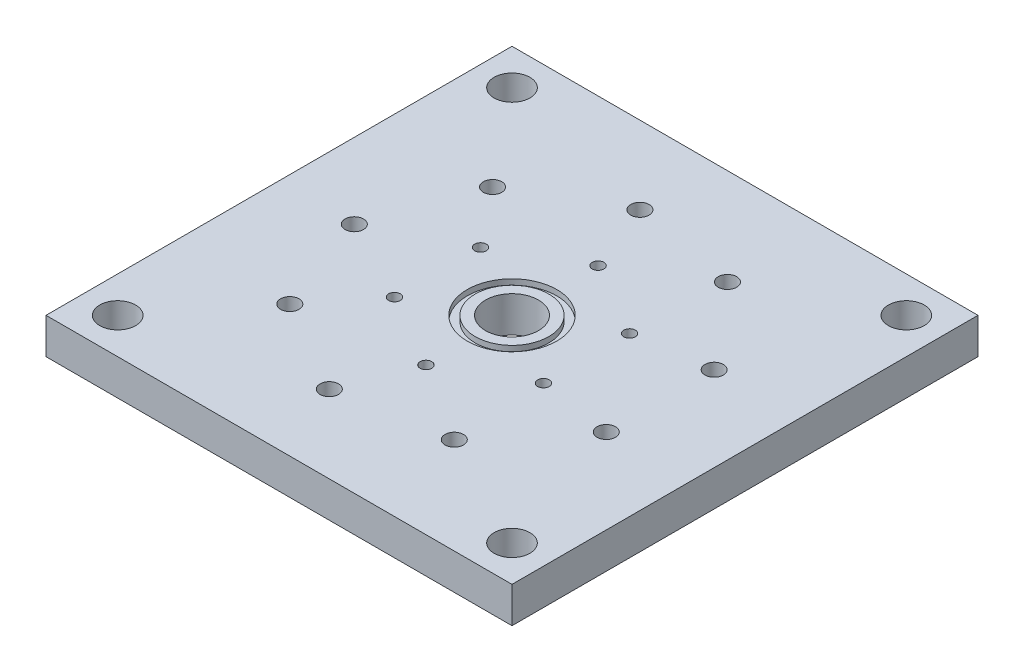
from build123d import *

# Parameters (mm, degrees)
SKETCH1_W           = 82.55
SKETCH1_H           = 82.55
BOSS_EXTRUDE1_DEPTH = 6.35
CUT_EXTRUDE1_REACH  = 60.716
SKETCH2_R           = 4.699
SKETCH4_R           = 7.9248
SKETCH4_R_2         = 6.5278
CUT_EXTRUDE3_DEPTH  = 0.9779
SKETCH5_R           = 1.03251
CUT_EXTRUDE4_DEPTH  = 3.175
CIRPATTERN1_COUNT   = 6
CUT_EXTRUDE5_REACH  = 60.716
SKETCH6_R           = 1.63195
CIRPATTERN2_COUNT   = 9
CUT_EXTRUDE6_REACH  = 60.716
SKETCH7_R           = 3.175


with BuildPart() as part:
    # Sketch1 → Boss-Extrude1 (new body)
    with BuildSketch(Plane(origin=(0, 0, 0), x_dir=(1, 0, 0), z_dir=(0, 1, 0))):
        Rectangle(SKETCH1_W, SKETCH1_H)
    extrude(amount=BOSS_EXTRUDE1_DEPTH)

    # Sketch2 → Cut-Extrude1 (cut, up to next)
    with BuildSketch(Plane(origin=(0, 6.35, 0), x_dir=(1, 0, 0), z_dir=(0, 1, 0)), mode=Mode.PRIVATE) as cut_extrude1_sk1:
        with Locations(Location((0, 0, 0), (0, 0, 270))):
            Circle(SKETCH2_R)
    cut_extrude1_tool1 = extrude(cut_extrude1_sk1.sketch, amount=-CUT_EXTRUDE1_REACH, mode=Mode.PRIVATE) & part.part
    add(cut_extrude1_tool1.solids().sort_by_distance((0, 6.35, 0))[0], mode=Mode.SUBTRACT)

    # Sketch4 → Cut-Extrude3 (cut)
    with BuildSketch(Plane(origin=(0, 6.35, 0), x_dir=(1, 0, 0), z_dir=(0, 1, 0))):
        with Locations(Location((0, 0, 0), (0, 0, 270))):
            Circle(SKETCH4_R)
        with Locations(Location((0, 0, 0), (0, 0, 270))):
            Circle(SKETCH4_R_2, mode=Mode.SUBTRACT)
    extrude(amount=-CUT_EXTRUDE3_DEPTH, mode=Mode.SUBTRACT)

    # Sketch5 → Cut-Extrude4 (cut)
    with BuildSketch(Plane(origin=(0, 6.35, 0), x_dir=(1, 0, 0), z_dir=(0, 1, 0))):
        with Locations(Location((0, -15.24, 0), (0, 0, 270))):
            Circle(SKETCH5_R)
    cut_extrude4 = extrude(amount=-CUT_EXTRUDE4_DEPTH, mode=Mode.SUBTRACT)

    # CirPattern1: Cut-Extrude4 ×6 about axis
    cirpattern1_axis = Axis((0, 0, 0), (0, 1, 0))
    for i in range(1, CIRPATTERN1_COUNT):
        add(cut_extrude4.rotate(cirpattern1_axis, i * 360 / CIRPATTERN1_COUNT), mode=Mode.SUBTRACT)

    # Sketch6 → Cut-Extrude5 (cut, up to next)
    with BuildSketch(Plane(origin=(0, 6.35, 0), x_dir=(1, 0, 0), z_dir=(0, 1, 0)), mode=Mode.PRIVATE) as cut_extrude5_sk1:
        with Locations(Location((13.97, -24.196749782, 0), (0, 0, 270))):
            Circle(SKETCH6_R)
    cut_extrude5_tool1 = extrude(cut_extrude5_sk1.sketch, amount=-CUT_EXTRUDE5_REACH, mode=Mode.PRIVATE) & part.part
    cut_extrude5 = cut_extrude5_tool1.solids().sort_by_distance((13.97, 6.35, 24.19675))[0]
    add(cut_extrude5, mode=Mode.SUBTRACT)

    # CirPattern2: Cut-Extrude5 ×9 about axis
    cirpattern2_axis = Axis((0, 0, 0), (0, 1, 0))
    for i in range(1, CIRPATTERN2_COUNT):
        add(cut_extrude5.rotate(cirpattern2_axis, i * 360 / CIRPATTERN2_COUNT), mode=Mode.SUBTRACT)

    # Sketch7 → Cut-Extrude6 (cut, up to next)
    with BuildSketch(Plane(origin=(0, 6.35, 0), x_dir=(1, 0, 0), z_dir=(0, 1, 0)), mode=Mode.PRIVATE) as cut_extrude6_sk1:
        with Locations(Location((34.925, 34.925, 0), (0, 0, 270))):
            Circle(SKETCH7_R)
    cut_extrude6_tool1 = extrude(cut_extrude6_sk1.sketch, amount=-CUT_EXTRUDE6_REACH, mode=Mode.PRIVATE) & part.part
    # Sketch7 → Cut-Extrude6 (cut, up to next)
    with BuildSketch(Plane(origin=(0, 6.35, 0), x_dir=(1, 0, 0), z_dir=(0, 1, 0)), mode=Mode.PRIVATE) as cut_extrude6_sk2:
        with Locations(Location((34.925, -34.925, 0), (0, 0, 90))):
            Circle(SKETCH7_R)
    cut_extrude6_tool2 = extrude(cut_extrude6_sk2.sketch, amount=-CUT_EXTRUDE6_REACH, mode=Mode.PRIVATE) & part.part
    # Sketch7 → Cut-Extrude6 (cut, up to next)
    with BuildSketch(Plane(origin=(0, 6.35, 0), x_dir=(1, 0, 0), z_dir=(0, 1, 0)), mode=Mode.PRIVATE) as cut_extrude6_sk3:
        with Locations(Location((-34.925, -34.925, 0), (0, 0, 270))):
            Circle(SKETCH7_R)
    cut_extrude6_tool3 = extrude(cut_extrude6_sk3.sketch, amount=-CUT_EXTRUDE6_REACH, mode=Mode.PRIVATE) & part.part
    # Sketch7 → Cut-Extrude6 (cut, up to next)
    with BuildSketch(Plane(origin=(0, 6.35, 0), x_dir=(1, 0, 0), z_dir=(0, 1, 0)), mode=Mode.PRIVATE) as cut_extrude6_sk4:
        with Locations(Location((-34.925, 34.925, 0), (0, 0, 90))):
            Circle(SKETCH7_R)
    cut_extrude6_tool4 = extrude(cut_extrude6_sk4.sketch, amount=-CUT_EXTRUDE6_REACH, mode=Mode.PRIVATE) & part.part
    add(cut_extrude6_tool1.solids().sort_by_distance((34.925, 6.35, -34.925))[0], mode=Mode.SUBTRACT)
    add(cut_extrude6_tool2.solids().sort_by_distance((34.925, 6.35, 34.925))[0], mode=Mode.SUBTRACT)
    add(cut_extrude6_tool3.solids().sort_by_distance((-34.925, 6.35, 34.925))[0], mode=Mode.SUBTRACT)
    add(cut_extrude6_tool4.solids().sort_by_distance((-34.925, 6.35, -34.925))[0], mode=Mode.SUBTRACT)


solid = part.part
